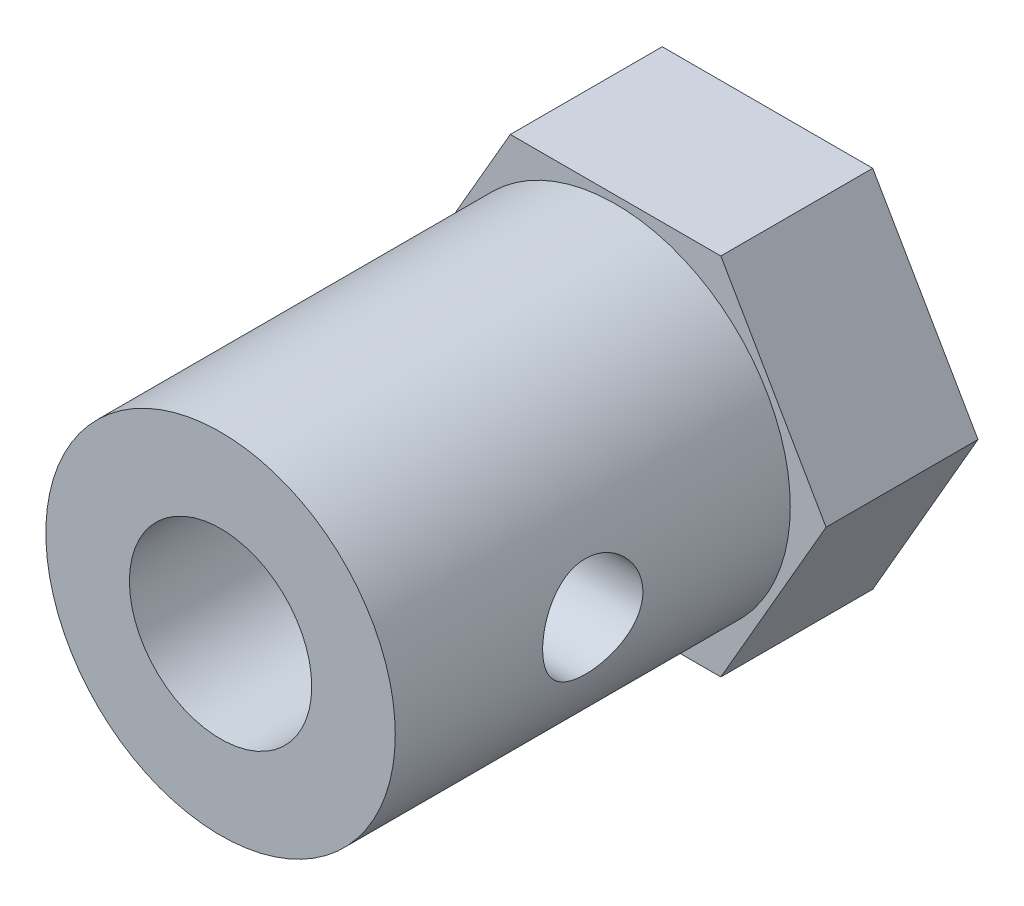
from build123d import *

# Parameters (mm, degrees)
SKETCH_1_R                = 2
F_12MM_5_M4_DEPTH         = 5
EXTRUDE_START             = 5
SKETCH_2_R                = 5.75
SKETCH_2_R_2              = 3
EXTRUDE_11_5_6_13_DEPTH   = 13
CUT_EXTRUDE_M4_DEPTH      = 21.199009877
CUT_EXTRUDE_M4_DEPTH_BACK = 21.199009877
SKETCH_3_R                = 1.65


with BuildPart() as part:
    # 草图1 → 轮毂端六角12mm_厚5_中心M4孔简化 (new body)
    with BuildSketch(Plane.XY):
        Polygon((6.92820323, 0), (3.464101615, 6), (-3.464101615, 6), (-6.92820323, 0), (-3.464101615, -6), (3.464101615, -6), align=None)
        Circle(SKETCH_1_R, mode=Mode.SUBTRACT)
    extrude(amount=F_12MM_5_M4_DEPTH)

    # 草图2 → 电机端_外径11.5_孔径6_长13 (add)
    with BuildSketch(Plane.XY.offset(EXTRUDE_START)):
        with Locations(Location((0, 0, 0), (0, 0, 180))):
            Circle(SKETCH_2_R)
        with Locations(Location((0, 0, 0), (0, 0, 180))):
            Circle(SKETCH_2_R_2, mode=Mode.SUBTRACT)
    extrude(amount=EXTRUDE_11_5_6_13_DEPTH)

    # 草图3 → M4紧定螺钉底孔_牙型简化 (cut, two sides: drawn at the far end of the back side and taken through both)
    with BuildSketch(Plane(origin=(0, 0, 0), x_dir=(0, 0, -1), z_dir=(1, 0, 0)).offset(-CUT_EXTRUDE_M4_DEPTH_BACK)):
        with Locations(Location((-11.5, 0, 0), (0, 0, 180))):
            Circle(SKETCH_3_R)
    extrude(amount=CUT_EXTRUDE_M4_DEPTH + CUT_EXTRUDE_M4_DEPTH_BACK, mode=Mode.SUBTRACT)


solid = part.part
